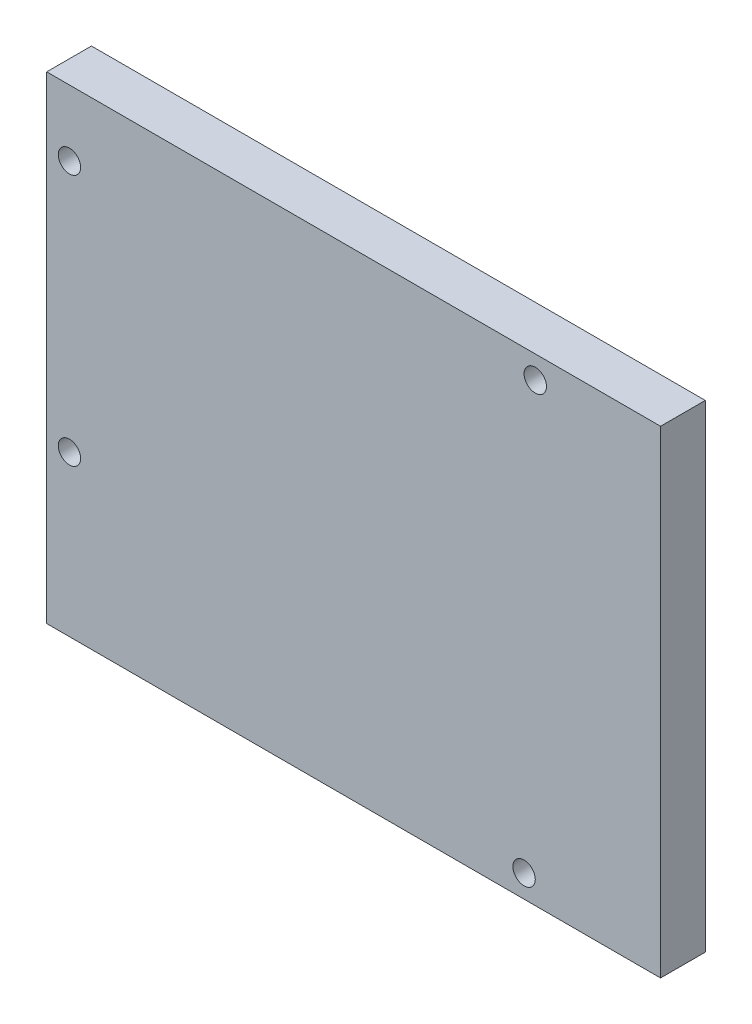
from build123d import *

# Parameters (mm, degrees)
SKETCH4_W                = 68.600000001
SKETCH4_H                = 53.4
BRACKETBASE_DEPTH        = 5
MOUNTINGHOLES_DEPTH      = 79.489210088
MOUNTINGHOLES_DEPTH_BACK = 79.489210088
MOUNTINGHOLESSKETCH_R    = 1.25


with BuildPart() as part:
    # Sketch4 → bracketBase (new body)
    with BuildSketch(Plane.XY):
        with Locations((34.3, 11.110000001)):
            Rectangle(SKETCH4_W, SKETCH4_H)
    extrude(amount=BRACKETBASE_DEPTH)

    # mountingHolesSketch → mountingHoles (cut, two sides: drawn at the far end of the back side and taken through both)
    with BuildSketch(Plane.XY.offset(-MOUNTINGHOLES_DEPTH_BACK)):
        with Locations((2.54, 2.280000001)):
            Circle(MOUNTINGHOLESSKETCH_R)
        with Locations((2.54, 30.450000001)):
            Circle(MOUNTINGHOLESSKETCH_R)
        with Locations((54.600000001, 35.270000001)):
            Circle(MOUNTINGHOLESSKETCH_R)
        with Locations((53.350000001, -13.049999999)):
            Circle(MOUNTINGHOLESSKETCH_R)
    extrude(amount=MOUNTINGHOLES_DEPTH + MOUNTINGHOLES_DEPTH_BACK, mode=Mode.SUBTRACT)


solid = part.part
